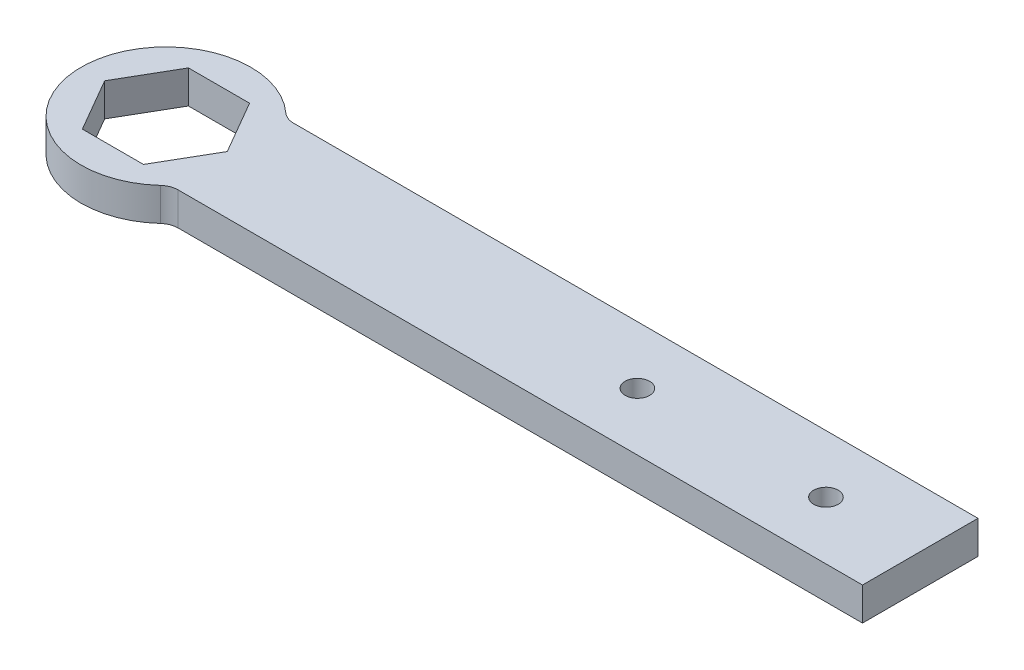
from build123d import *

# Parameters (mm, degrees)
BOSS_EXTRUDE1_DEPTH = 4.445
SKETCH2_R           = 1.651
CUT_EXTRUDE1_DEPTH  = 108.429567879


with BuildPart() as part:
    # Sketch1 → Boss-Extrude1 (new body)
    with BuildSketch(Plane(origin=(0, 0, 0), x_dir=(1, 0, 0), z_dir=(0, 1, 0))):
        with BuildLine():
            Line((13.535585603, 0.635), (105.718351485, 0.635))
            Line((105.718351485, 0.635), (105.718351485, -14.9225))
            Line((105.718351485, -14.9225), (13.535585603, -14.9225))
            ThreePointArc((13.535585603, -14.9225), (12.61737712, -15.094274254), (11.823361218, -15.586363636))
            ThreePointArc((11.823361218, -15.586363636), (-7.311648515, -7.14375), (11.823361218, 1.298863636))
            ThreePointArc((11.823361218, 1.298863636), (12.61737712, 0.806774254), (13.535585603, 0.635))
        make_face()
        Polygon((0, 0), (8.23670297, 0), (12.373351485, -7.14375), (8.23670297, -14.2875), (0, -14.2875), (-4.136648515, -7.14375), align=None, mode=Mode.SUBTRACT)
    extrude(amount=BOSS_EXTRUDE1_DEPTH)

    # Sketch2 → Cut-Extrude1 (cut, through all)
    with BuildSketch(Plane(origin=(0, 4.445, 0), x_dir=(1, 0, 0), z_dir=(0, 1, 0))):
        with Locations(Location((93.018351485, -7.14375, 0), (0, 0, 270))):
            Circle(SKETCH2_R)
        with Locations(Location((67.618351485, -7.14375, 0), (0, 0, 270))):
            Circle(SKETCH2_R)
    extrude(amount=-CUT_EXTRUDE1_DEPTH, mode=Mode.SUBTRACT)


solid = part.part
